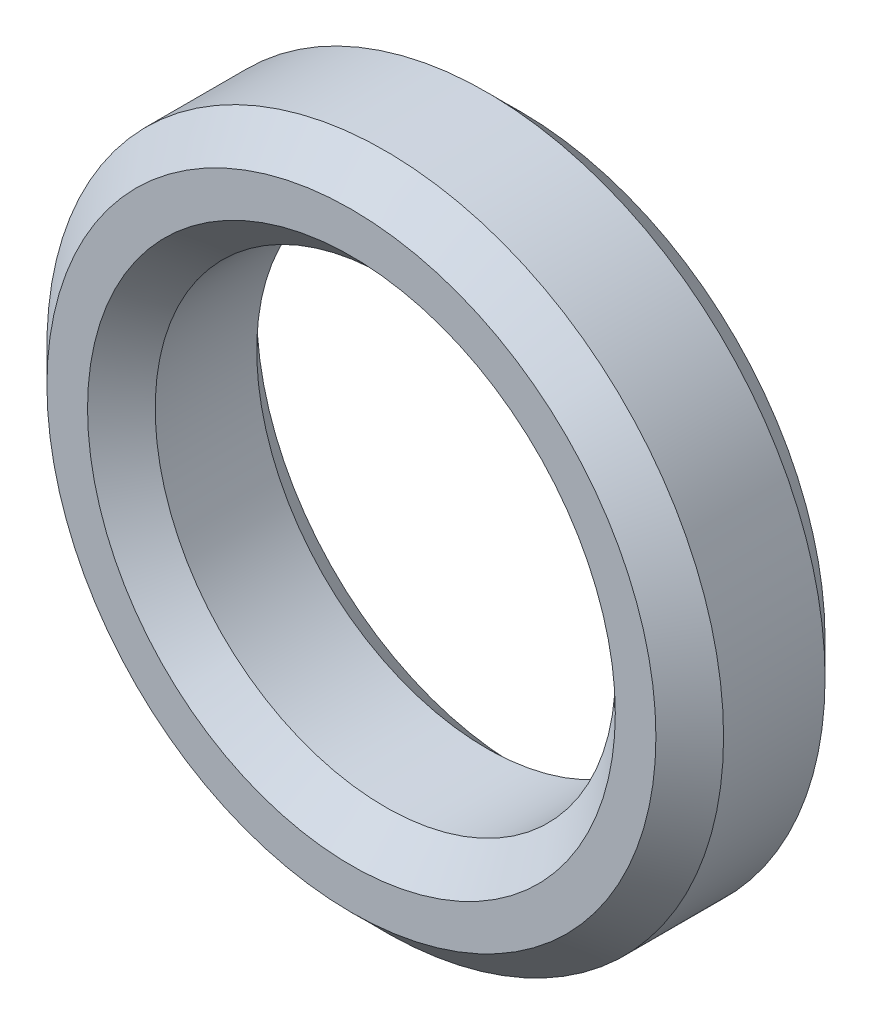
from build123d import *

# Parameters (mm, degrees)
SKETCH1_R               = 10
SKETCH1_R_2             = 7
MAIN_BODY_EXTRUDE_DEPTH = 2.5
F_2_OFFSET_BY           = 0.2
CHAMFER1_SIZE           = 1


with BuildPart() as part:
    # Sketch1 → Main Body Extrude (new, symmetric)
    with BuildSketch(Plane.XY):
        Circle(SKETCH1_R)
        Circle(SKETCH1_R_2, mode=Mode.SUBTRACT)
    extrude(amount=MAIN_BODY_EXTRUDE_DEPTH, both=True)

    # .2 Offset: a curved face moved outward by 0.2
    add(Solid.thicken(part.faces().sort_by_distance((-7, 0, 0))[0], F_2_OFFSET_BY))

    # Chamfer1
    chamfer1_edges = [part.edges().sort_by_distance(p)[0] for p in [
        (-10, 0, 2.5),
        (-10, 0, -2.5),
        (-6.8, 0, -2.5),
        (-6.8, 0, 2.5),
    ]]
    chamfer(chamfer1_edges, length=CHAMFER1_SIZE)


solid = part.part
